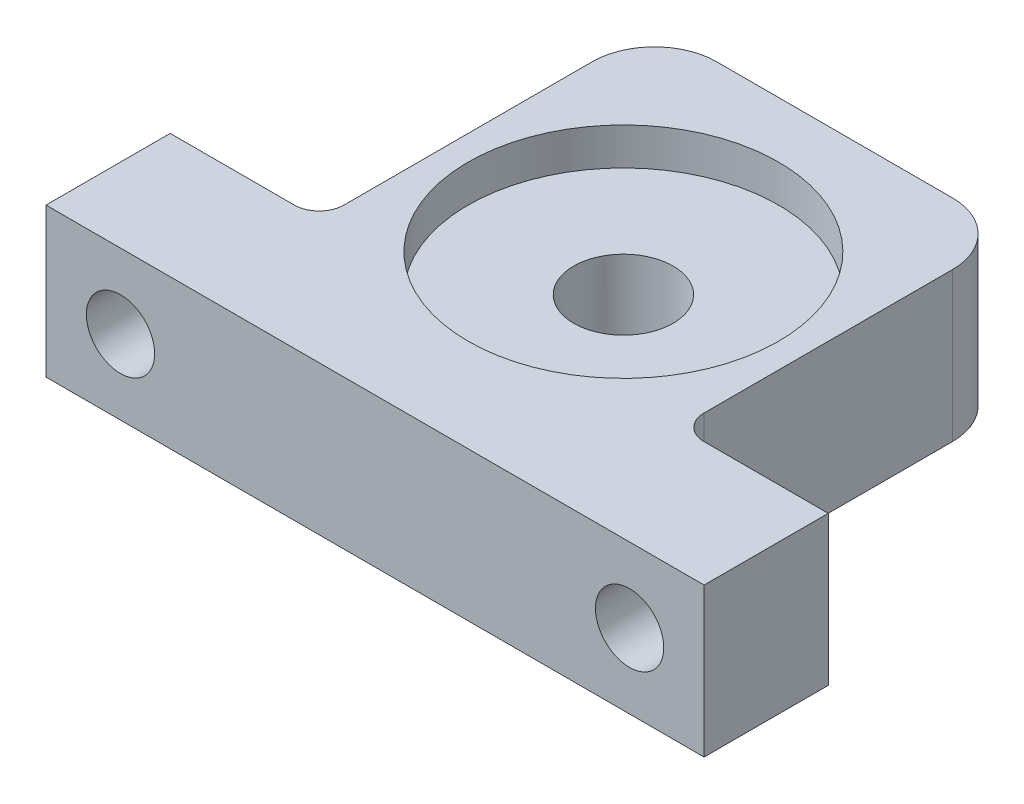
from build123d import *

# Parameters (mm, degrees)
EXTRUDE_1_DEPTH     = 6
FILLET_1_R          = 2
SKETCH_2_R          = 2.75
CUT_EXTRUDE_1_DEPTH = 140
SKETCH_3_R          = 9
CUT_EXTRUDE_2_DEPTH = 2
SKETCH_5_R          = 12.5
CUT_EXTRUDE_4_DEPTH = 3
SKETCH_6_R          = 4
CUT_EXTRUDE_5_DEPTH = 76


with BuildPart() as part:
    # 草图1 → 凸台-拉伸1 (new, symmetric)
    with BuildSketch(Plane(origin=(0, 0, 0), x_dir=(1, 0, 0), z_dir=(0, 1, 0))):
        with BuildLine():
            Line((14.5, 5), (26.5, 5))
            Line((26.5, 5), (26.5, -5))
            Line((26.5, -5), (-26.5, -5))
            Line((-26.5, -5), (-26.5, 5))
            Line((-26.5, 5), (-14.5, 5))
            Line((-14.5, 5), (-14.5, 27))
            ThreePointArc((-14.5, 27), (-13.035533906, 30.535533906), (-9.5, 32))
            Line((-9.5, 32), (9.5, 32))
            ThreePointArc((9.5, 32), (13.035533906, 30.535533906), (14.5, 27))
            Line((14.5, 27), (14.5, 5))
        make_face()
    extrude(amount=EXTRUDE_1_DEPTH, both=True)

    # 圆角1
    fillet_1_edges = [part.edges().sort_by_distance(p)[0] for p in [
        (-14.5, 0, -5),
        (14.5, 0, -5),
    ]]
    fillet(fillet_1_edges, radius=FILLET_1_R)

    # 草图2 → 切除-拉伸1 (cut, symmetric)
    with BuildSketch(Plane(origin=(0, 0, -5), x_dir=(-1, 0, 0), z_dir=(0, 0, -1))):
        with Locations((20.5, 0)):
            Circle(SKETCH_2_R)
        with Locations((-20.5, 0)):
            Circle(SKETCH_2_R)
    extrude(amount=CUT_EXTRUDE_1_DEPTH, both=True, mode=Mode.SUBTRACT)

    # 草图3 → 切除-拉伸2 (cut)
    with BuildSketch(Plane.XZ.offset(6)):
        with Locations(Location((0, -15, 0), (0, 0, 270))):
            Circle(SKETCH_3_R)
    extrude(amount=-CUT_EXTRUDE_2_DEPTH, mode=Mode.SUBTRACT)

    # 草图5 → 切除-拉伸4 (cut)
    with BuildSketch(Plane(origin=(0, 6, 0), x_dir=(1, 0, 0), z_dir=(0, 1, 0))):
        with Locations(Location((0, 15, 0), (0, 0, 270))):
            Circle(SKETCH_5_R)
    extrude(amount=-CUT_EXTRUDE_4_DEPTH, mode=Mode.SUBTRACT)

    # 草图6 → 切除-拉伸5 (cut)
    with BuildSketch(Plane(origin=(0, 3, 0), x_dir=(1, 0, 0), z_dir=(0, 1, 0))):
        with Locations(Location((0, 15, 0), (0, 0, 270))):
            Circle(SKETCH_6_R)
    extrude(amount=-CUT_EXTRUDE_5_DEPTH, mode=Mode.SUBTRACT)


solid = part.part
